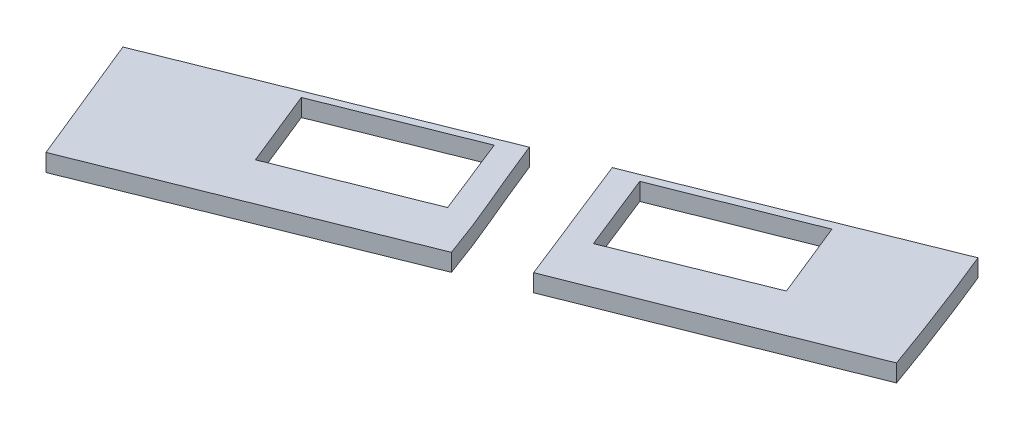
from build123d import *

# Parameters (mm, degrees)
SKETCH1_R           = 1.281558591
SKETCH1_R_2         = 1.27912149
BOSS_EXTRUDE1_DEPTH = 1.19
CUT_EXTRUDE1_DEPTH  = 2.54
CUT_EXTRUDE2_DEPTH  = 9.906


with BuildPart() as part:
    # Sketch1 → Boss-Extrude1 (new body)
    with BuildSketch(Plane(origin=(0, 0, 0), x_dir=(1, 0, 0), z_dir=(0, 1, 0))):
        with BuildLine():
            Line((-3.948168159, 25.857752235), (34.708440024, 30.372559307))
            add(Edge.make_bspline(
                [(34.708440024, 30.372559307), (34.942308086, 29.862573914), (35.216465801, 29.369202379), (35.41004421, 28.842603127), (35.634944676, 28.230797202), (35.768879722, 27.589205916), (35.960617271, 26.966210393), (35.965938184, 26.948921629), (35.991057299, 26.944232956), (35.999261802, 26.928111554), (36.743885485, 25.464966639), (37.564180772, 24.036910168), (38.217825185, 22.530919978), (38.865327395, 21.039081363), (40.441376905, 16.960362547), (41.306486039, 14.494420913)],
                knots=[0, 0, 0, 0, 1, 1, 1, 2, 2, 2, 3, 3, 3, 4, 4, 4, 5, 5, 5, 5], degree=3))
            Line((41.306486039, 14.494420913), (26.379308433, 8.556241677))
            Line((26.379308433, 8.556241677), (21.571141955, 20.672821201))
            add(Edge.make_bspline(
                [(21.571141955, 20.672821201), (21.634910972, 21.018173468), (21.748594484, 21.35796102), (21.762449005, 21.708878001), (21.774151999, 22.005299603), (21.695806289, 22.298709609), (21.646885264, 22.591300552), (21.643902496, 22.609140136), (21.617478501, 22.613950002), (21.608496587, 22.629649458), (21.454882222, 22.898151457), (21.383454938, 23.23493464), (21.147653492, 23.435155456), (20.905488639, 23.64077949), (20.692579942, 23.888331524), (20.418328284, 24.048678297), (20.15986613, 24.199793417), (19.870796872, 24.315401802), (19.574055785, 24.355191149), (19.180278137, 24.407991911), (18.74328259, 24.448836406), (18.384663016, 24.277837116), (18.13147516, 24.157110455), (17.87065401, 24.052846943), (17.617466154, 23.932120282), (17.601139945, 23.924335514), (17.591549832, 23.906868519), (17.579117247, 23.893731605), (17.361458227, 23.66374179), (17.104351703, 23.465224478), (16.927205729, 23.202755302), (16.779704543, 22.984209467), (16.687302856, 22.728685321), (16.62063322, 22.473589178), (16.545622255, 22.186576842), (16.544200548, 21.885227936), (16.505984212, 21.591047315)],
                knots=[0, 0, 0, 0, 1, 1, 1, 2, 2, 2, 3, 3, 3, 4, 4, 4, 5, 5, 5, 6, 6, 6, 7, 7, 7, 8, 8, 8, 9, 9, 9, 10, 10, 10, 11, 11, 11, 12, 12, 12, 12], degree=3))
            add(Edge.make_bspline(
                [(16.505984212, 21.591047315), (16.518782353, 21.578266264), (16.539801332, 21.570202619), (16.544378636, 21.552704162), (16.617400623, 21.273550308), (16.663764579, 20.987872856), (16.736786566, 20.708719002), (16.806805853, 20.441044093), (17.044044502, 20.24849863), (17.19767347, 20.018388445), (17.465578341, 19.617112304), (18.031163484, 19.577799481), (18.234246012, 19.098229697), (19.127510948, 16.988826809), (19.346682772, 16.331345691), (20.002158395, 14.686998305), (21.518894597, 10.882064728), (22.011547535, 9.986611514), (22.99992287, 7.207084206)],
                knots=[0, 0, 0, 0, 1, 1, 1, 2, 2, 2, 3, 3, 3, 4, 4, 4, 5, 5, 5, 6, 6, 6, 6], degree=3))
            Line((22.99992287, 7.207084206), (6.371709484, 0.524718752))
            Line((6.371709484, 0.524718752), (-3.948168159, 25.857752235))
        make_face()
        with Locations(Location((31.581994118, 27.844041808, 0), (0, 0, 270))):
            Circle(SKETCH1_R, mode=Mode.SUBTRACT)
        with Locations(Location((4.443945521, 18.622159212, 0), (0, 0, 270))):
            Circle(SKETCH1_R_2, mode=Mode.SUBTRACT)
        Polygon((29.528011628, 24.668032897), (31.295389474, 20.292362952), (24.334912298, 17.497443293), (22.582661714, 21.866014987), align=None, mode=Mode.SUBTRACT)
        Polygon((16.577782643, 19.493154262), (18.362295388, 15.097963812), (11.376540447, 12.313291502), (9.611482192, 16.686576517), align=None, mode=Mode.SUBTRACT)
        Polygon((32.786623967, 19.298845197), (34.559807218, 14.90935059), (26.647925888, 11.722355727), (24.882600183, 16.153609635), align=None, mode=Mode.SUBTRACT)
        Polygon((18.898363139, 13.77263465), (20.661300607, 9.324417197), (12.759882633, 6.178035225), (10.974286829, 10.601867258), align=None, mode=Mode.SUBTRACT)
    extrude(amount=BOSS_EXTRUDE1_DEPTH)

    # Sketch2 → Cut-Extrude1 (cut)
    with BuildSketch(Plane.XZ):
        Polygon((0.587242747, -6.884275357), (39.490843961, -22.50554763), (39.490843961, -43.06449087), (-7.692806902, -25.9504125), align=None)
    extrude(amount=-CUT_EXTRUDE1_DEPTH, mode=Mode.SUBTRACT)


with BuildPart() as cut_extrude1_piece_1:
    # of the separate pieces the step leaves, piece 1, a body of its own (cut_extrude1_pieces)
    add(part.part.solids().sort_by_distance((6.371709484, 0, -0.524718752))[0])


with BuildPart() as cut_extrude1_piece_2:
    # of the separate pieces the step leaves, piece 2, a body of its own (cut_extrude1_pieces)
    add(part.part.solids().sort_by_distance((38.41229244, 0, -22.072468263))[0])


with BuildPart() as cut_extrude2_tool:
    # Sketch4 → Cut-Extrude2 (new body)
    with BuildSketch(Plane(origin=(-2.298949217, 0, -5.725359753), x_dir=(-0.9279837403895839, 0, 0.37262068859975767), z_dir=(-0.37262068859975767, 0, -0.9279837403895839))):
        Polygon((-6.067991774, 0.19), (-45.594810032, 0.19), (-45.594810032, -0.619411818), (-5.559501148, -0.619411818), align=None)
    extrude(amount=-CUT_EXTRUDE2_DEPTH)


with BuildPart() as cut_extrude1_piece_1_1:
    add(cut_extrude1_piece_1.part)

    # Cut-Extrude2: cut by cut_extrude2_tool
    add(cut_extrude2_tool.part, mode=Mode.SUBTRACT)


with BuildPart() as cut_extrude1_piece_2_1:
    add(cut_extrude1_piece_2.part)

    # Cut-Extrude2: cut by cut_extrude2_tool
    add(cut_extrude2_tool.part, mode=Mode.SUBTRACT)


solid = Compound([cut_extrude1_piece_1_1.part, cut_extrude1_piece_2_1.part])
